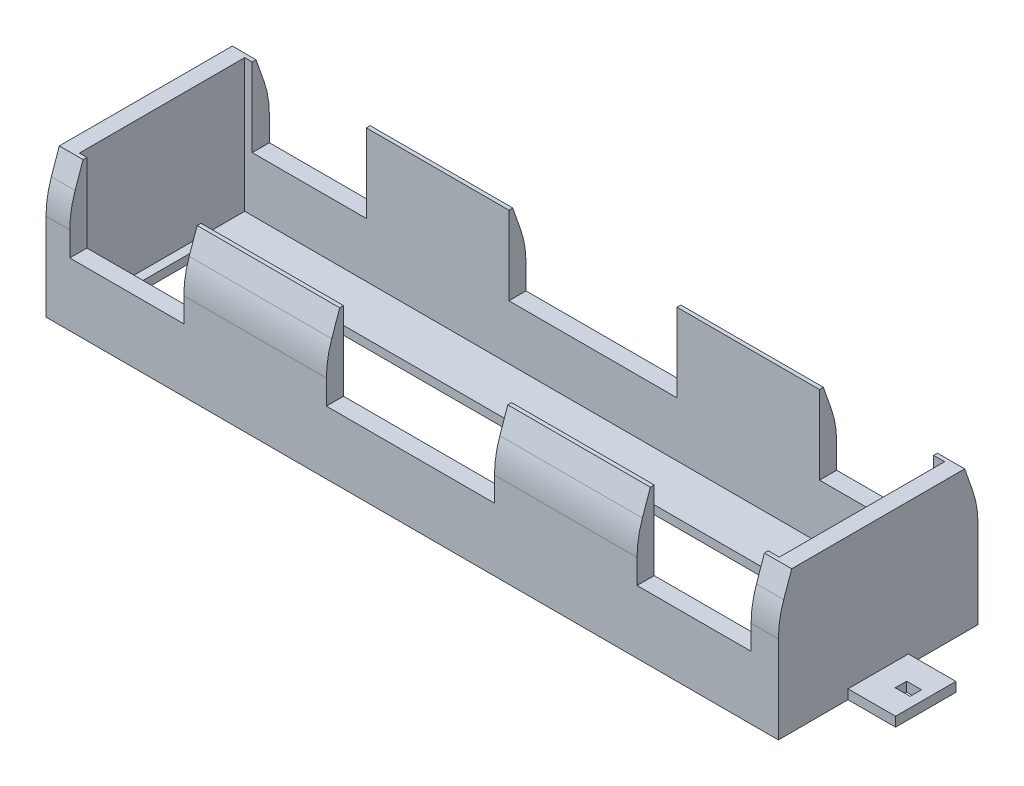
from build123d import *

# Parameters (mm, degrees)
BOSS_EXTRU_1_DEPTH      = 77.05
ESQUISSE3_W             = 10
ESQUISSE3_H             = 6.35
BOSS_EXTRU_2_DEPTH      = 1
ESQUISSE5_W             = 1.539298861
ESQUISSE5_H             = 1.197636308
ESQUISSE5_W_2           = 1.565261684
ENL_V_MAT_EXTRU_1_DEPTH = 1
ESQUISSE6_W             = 73.632054576
ESQUISSE6_H             = 17.392646246
ENL_V_MAT_EXTRU_2_DEPTH = 14
ESQUISSE7_W             = 71.72564692
ESQUISSE7_H             = 6.995918618
ENL_V_MAT_EXTRU_3_DEPTH = 16
ESQUISSE8_W             = 12
ESQUISSE8_H             = 8.25967539
ESQUISSE8_W_2           = 17.68111001
ENL_V_MAT_EXTRU_4_DEPTH = 23
CONG_1_R                = 10


with BuildPart() as part:
    # Esquisse1 → Boss.-Extru.1 (new body)
    with BuildSketch(Plane(origin=(0, 0, 0), x_dir=(0, 0, -1), z_dir=(1, 0, 0))):
        Polygon((-10.5, 10.9), (-9.1, 14.9), (9.1, 14.9), (10.5, 10.9), (10.5, 0), (-10.5, 0), align=None)
    extrude(amount=BOSS_EXTRU_1_DEPTH)

    # Esquisse3 → Boss.-Extru.2 (add)
    with BuildSketch(Plane.XZ):
        Rectangle(ESQUISSE3_W, ESQUISSE3_H)
        with Locations((77.05, 0)):
            Rectangle(ESQUISSE3_W, ESQUISSE3_H)
    extrude(amount=-BOSS_EXTRU_2_DEPTH)

    # Esquisse5 → Enlèv. mat.-Extru.1 (cut)
    with BuildSketch(Plane.XZ):
        with Locations((-3.397480153, 0)):
            Rectangle(ESQUISSE5_W, ESQUISSE5_H)
        with Locations((80.22152685, 0)):
            Rectangle(ESQUISSE5_W_2, ESQUISSE5_H)
    extrude(amount=-ENL_V_MAT_EXTRU_1_DEPTH, mode=Mode.SUBTRACT)

    # Esquisse6 → Enlèv. mat.-Extru.2 (cut)
    with BuildSketch(Plane(origin=(0, 14.9, 0), x_dir=(1, 0, 0), z_dir=(0, 1, 0))):
        with Locations((38.525, 0)):
            Rectangle(ESQUISSE6_W, ESQUISSE6_H)
    extrude(amount=-ENL_V_MAT_EXTRU_2_DEPTH, mode=Mode.SUBTRACT)

    # Esquisse7 → Enlèv. mat.-Extru.3 (cut)
    with BuildSketch(Plane(origin=(0, 14.9, 0), x_dir=(1, 0, 0), z_dir=(0, 1, 0))):
        with Locations((38.525, 0)):
            Rectangle(ESQUISSE7_W, ESQUISSE7_H)
    extrude(amount=-ENL_V_MAT_EXTRU_3_DEPTH, mode=Mode.SUBTRACT)

    # Esquisse8 → Enlèv. mat.-Extru.4 (cut)
    with BuildSketch(Plane.XY.offset(10.5)):
        with Locations((8.5, 10.770162305)):
            Rectangle(ESQUISSE8_W, ESQUISSE8_H)
        with Locations((38.340555005, 10.770162305)):
            Rectangle(ESQUISSE8_W_2, ESQUISSE8_H)
        with Locations((68.18111001, 10.770162305)):
            Rectangle(ESQUISSE8_W, ESQUISSE8_H)
    extrude(amount=-ENL_V_MAT_EXTRU_4_DEPTH, mode=Mode.SUBTRACT)

    # Congé1
    cong_1_edges = [part.edges().sort_by_distance(p)[0] for p in [
        (75.615555005, 10.9, 10.5),
        (75.615555005, 10.9, -10.5),
        (1.25, 10.9, 10.5),
        (1.25, 10.9, -10.5),
        (22, 10.9, 10.5),
        (22, 10.9, -10.5),
        (54.68111001, 10.9, 10.5),
        (54.68111001, 10.9, -10.5),
    ]]
    fillet(cong_1_edges, radius=CONG_1_R)


solid = part.part
